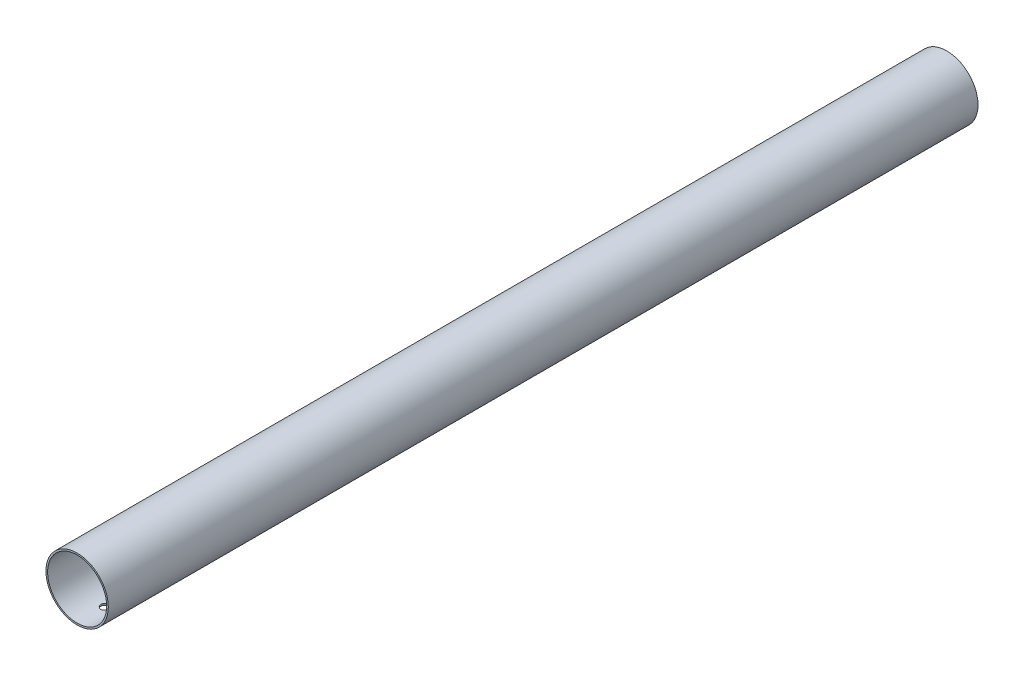
from build123d import *

# Parameters (mm, degrees)
ESQUISSE1_R             = 19
ESQUISSE1_R_2           = 18
BOSS_EXTRU_1_DEPTH      = 530
ESQUISSE2_R             = 2.5
ENL_V_MAT_EXTRU_1_DEPTH = 531.680694957
ESQUISSE4_R             = 2.5
ENL_V_MAT_EXTRU_2_DEPTH = 531.680695064


with BuildPart() as part:
    # Esquisse1 → Boss.-Extru.1 (new body)
    with BuildSketch(Plane.XY):
        Circle(ESQUISSE1_R)
        Circle(ESQUISSE1_R_2, mode=Mode.SUBTRACT)
    extrude(amount=BOSS_EXTRU_1_DEPTH)

    # Esquisse2 → Enlèv. mat.-Extru.1 (cut, through all)
    with BuildSketch(Plane(origin=(0, 0, 0), x_dir=(1, 0, 0), z_dir=(0, 1, 0))):
        with Locations(Location((0, -17, 0), (0, 0, 270))):
            Circle(ESQUISSE2_R)
    extrude(amount=-ENL_V_MAT_EXTRU_1_DEPTH, mode=Mode.SUBTRACT)

    # Esquisse4 → Enlèv. mat.-Extru.2 (cut, through all)
    with BuildSketch(Plane(origin=(0, 0, 0), x_dir=(1, 0, 0), z_dir=(0, 1, 0))):
        with Locations(Location((0, -513, 0), (0, 0, 270))):
            Circle(ESQUISSE4_R)
    extrude(amount=-ENL_V_MAT_EXTRU_2_DEPTH, mode=Mode.SUBTRACT)


solid = part.part
